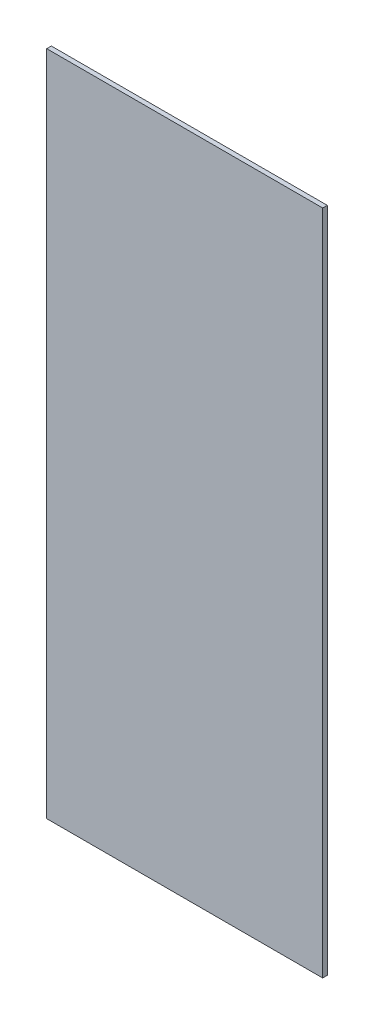
from build123d import *

# Parameters (mm, degrees)
SKETCH1_W           = 120
SKETCH1_H           = 290
BOSS_EXTRUDE1_DEPTH = 2


with BuildPart() as part:
    # Sketch1 → Boss-Extrude1 (new body)
    with BuildSketch(Plane.XY):
        Rectangle(SKETCH1_W, SKETCH1_H)
    extrude(amount=BOSS_EXTRUDE1_DEPTH)


solid = part.part
